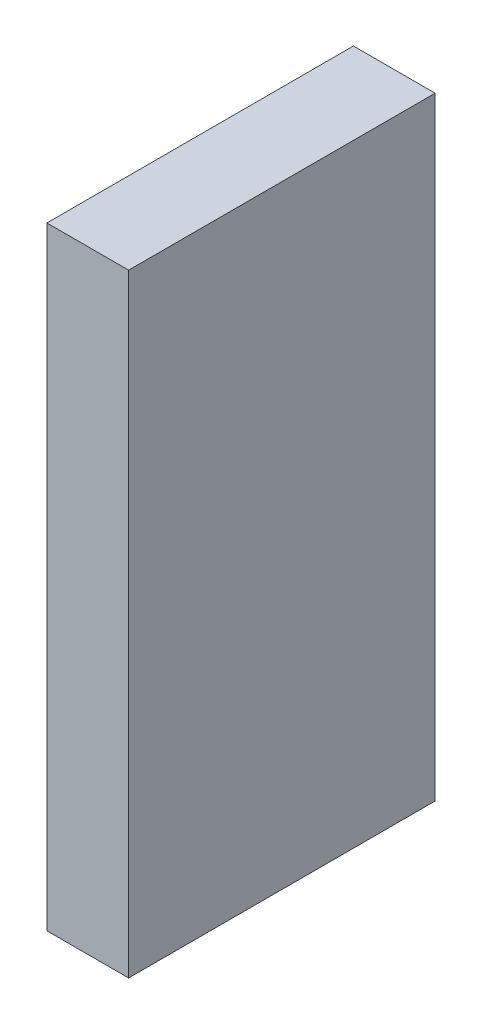
from build123d import *

# Parameters (mm, degrees)
PACK_FLAP_PARMAGI_3_1_START = -185
SKETCH1_W                   = 8
SKETCH1_H                   = 60
PACK_FLAP_PARMAGI_3_1_DEPTH = 30


with BuildPart() as part:
    # Sketch1 → PACK_flap_parmagi_3_1 (new body)
    with BuildSketch(Plane.XY.offset(PACK_FLAP_PARMAGI_3_1_START)):
        with Locations((550, 730)):
            Rectangle(SKETCH1_W, SKETCH1_H)
    extrude(amount=-PACK_FLAP_PARMAGI_3_1_DEPTH)


solid = part.part
